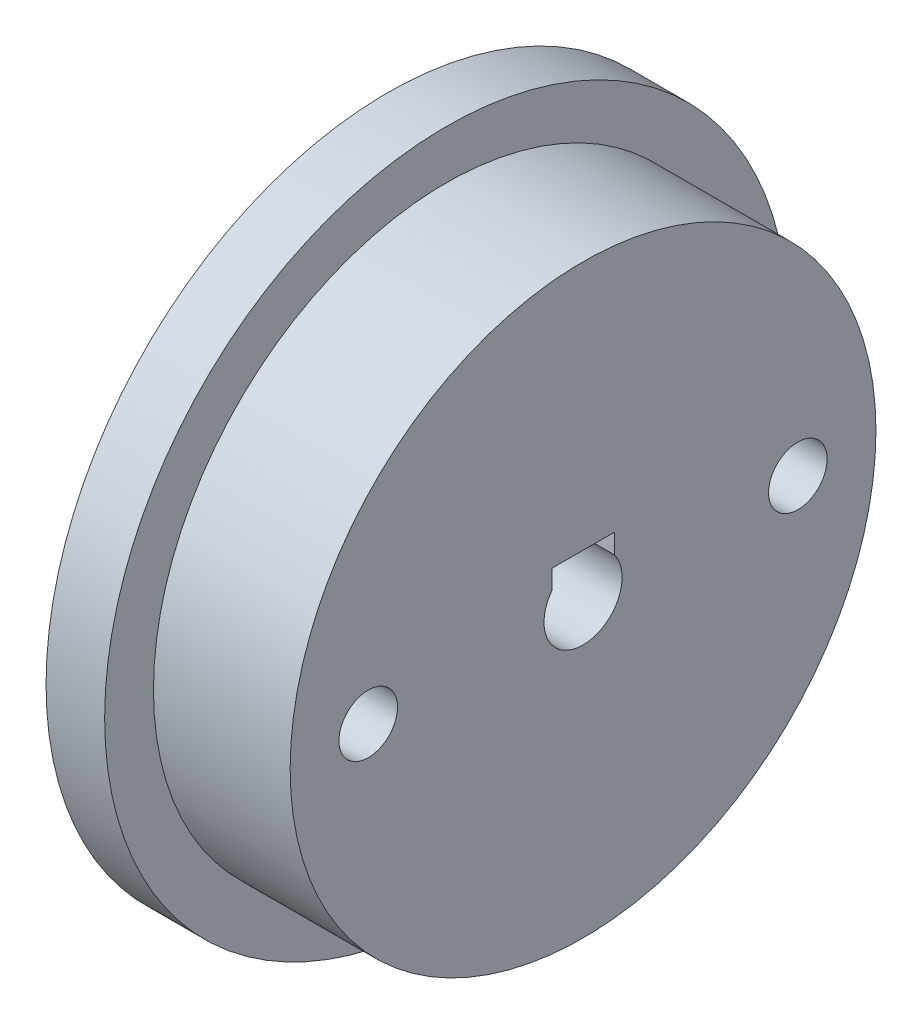
from build123d import *

# Parameters (mm, degrees)
SKETCH2_R          = 1.5
CUT_EXTRUDE1_DEPTH = 27.69269563


with BuildPart() as part:
    # Sketch1 → Revolve1 (revolve)
    with BuildSketch(Plane.XY, mode=Mode.PRIVATE) as revolve1_sk:
        Polygon((0, 0), (0, 17.5), (3, 17.5), (3, 15), (10, 15), (10, 0), align=None)
    revolve(revolve1_sk.sketch.rotate(Axis((0, 0, 0), (1, 0, 0)), 90), axis=Axis((0, 0, 0), (1, 0, 0)))

    # Sketch2 → Cut-Extrude1 (cut, through all)
    with BuildSketch(Plane(origin=(10, 0, 0), x_dir=(0, 0, -1), z_dir=(1, 0, 0))):
        with Locations((-11, 0)):
            Circle(SKETCH2_R)
        with Locations(Location((11, 0, 0), (0, 0, 180))):
            Circle(SKETCH2_R)
        with BuildLine():
            Line((-1.6, 1.2), (-1.6, 2.2))
            Line((-1.6, 2.2), (1.6, 2.2))
            Line((1.6, 2.2), (1.6, 1.2))
            ThreePointArc((1.6, 1.2), (0, -2), (-1.6, 1.2))
        make_face()
    extrude(amount=-CUT_EXTRUDE1_DEPTH, mode=Mode.SUBTRACT)


solid = part.part
